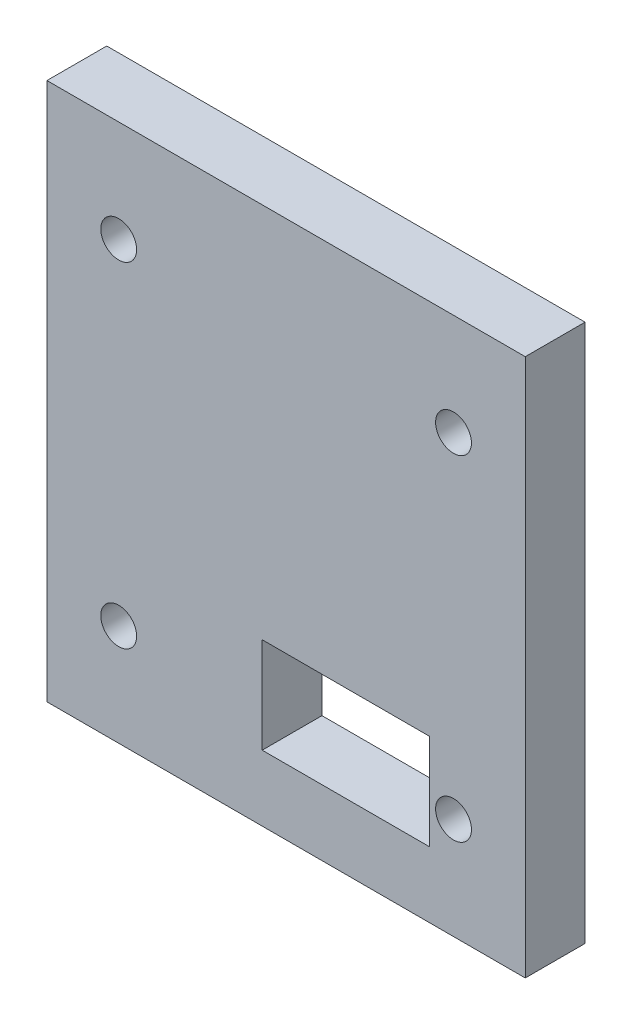
from build123d import *

# Parameters (mm, degrees)
SKETCH1_W           = 35
SKETCH1_H           = 45
BOSS_EXTRUDE1_DEPTH = 5
SKETCH2_R           = 1.5
CUT_EXTRUDE1_DEPTH  = 5
SKETCH4_W           = 5
SKETCH4_H           = 45
BOSS_EXTRUDE2_DEPTH = 2.5
SKETCH5_W           = 5
SKETCH5_H           = 45
BOSS_EXTRUDE3_DEPTH = 2.5
SKETCH6_R           = 1.5
CUT_EXTRUDE2_DEPTH  = 5
SKETCH7_W           = 14
SKETCH7_H           = 8
CUT_EXTRUDE3_DEPTH  = 5


with BuildPart() as part:
    # Sketch1 → Boss-Extrude1 (new body)
    with BuildSketch(Plane.XY):
        with Locations((17.5, 22.5)):
            Rectangle(SKETCH1_W, SKETCH1_H)
    extrude(amount=BOSS_EXTRUDE1_DEPTH)

    # Sketch2 → Cut-Extrude1 (cut)
    with BuildSketch(Plane.XZ):
        with Locations(Location((2, 2.5, 0), (0, 0, 270))):
            Circle(SKETCH2_R)
        with Locations(Location((33, 2.5, 0), (0, 0, 270))):
            Circle(SKETCH2_R)
        with Locations(Location((9.75, 2.5, 0), (0, 0, 270))):
            Circle(SKETCH2_R)
        with Locations(Location((25.25, 2.5, 0), (0, 0, 270))):
            Circle(SKETCH2_R)
    extrude(amount=-CUT_EXTRUDE1_DEPTH, mode=Mode.SUBTRACT)

    # Sketch4 → Boss-Extrude2 (add)
    with BuildSketch(Plane(origin=(35, 0, 0), x_dir=(0, 0, -1), z_dir=(1, 0, 0))):
        with Locations((-2.5, 22.5)):
            Rectangle(SKETCH4_W, SKETCH4_H)
    extrude(amount=BOSS_EXTRUDE2_DEPTH)

    # Sketch5 → Boss-Extrude3 (add)
    with BuildSketch(Plane.ZY):
        with Locations((2.5, 22.5)):
            Rectangle(SKETCH5_W, SKETCH5_H)
    extrude(amount=BOSS_EXTRUDE3_DEPTH)

    # Sketch6 → Cut-Extrude2 (cut)
    with BuildSketch(Plane.XY.offset(5)):
        with Locations((3.5, 36.5)):
            Circle(SKETCH6_R)
        with Locations((31.5, 8.5)):
            Circle(SKETCH6_R)
        with Locations((31.5, 36.5)):
            Circle(SKETCH6_R)
        with Locations((3.5, 8.5)):
            Circle(SKETCH6_R)
    extrude(amount=-CUT_EXTRUDE2_DEPTH, mode=Mode.SUBTRACT)

    # Sketch7 → Cut-Extrude3 (cut)
    with BuildSketch(Plane.XY.offset(5)):
        with Locations((22.5, 9.5)):
            Rectangle(SKETCH7_W, SKETCH7_H)
    extrude(amount=-CUT_EXTRUDE3_DEPTH, mode=Mode.SUBTRACT)


solid = part.part
